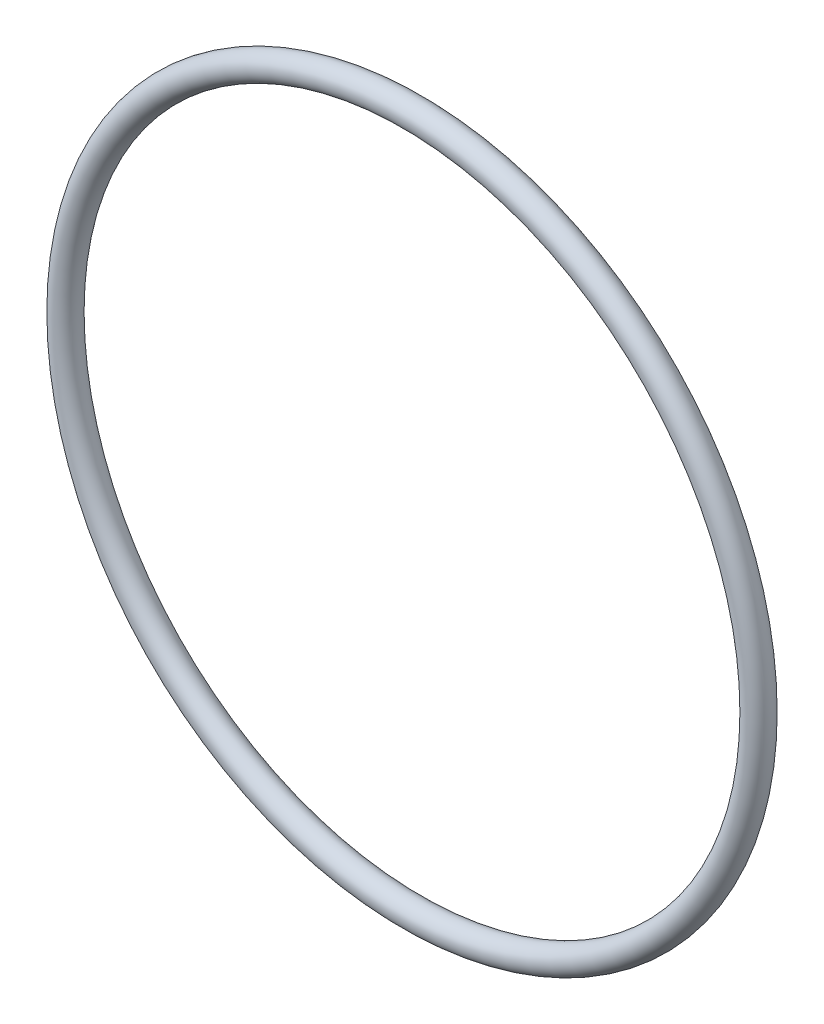
from build123d import *

# Parameters (mm, degrees)
SKETCH2_R = 1.325


with BuildPart() as part:
    # Sweep1: sweep along a path in Sketch1
    with BuildLine(Plane.XY) as sweep1_path:
        CenterArc((0, 0), 33.5, 0, 360)
    # Sketch2 → Sweep1 (sweep)
    with BuildSketch(Plane(origin=(0, 0, 0), x_dir=(1, 0, 0), z_dir=(0, 1, 0))):
        with Locations((-34.825, 0)):
            Circle(SKETCH2_R)
    sweep(path=sweep1_path.line)


solid = part.part
